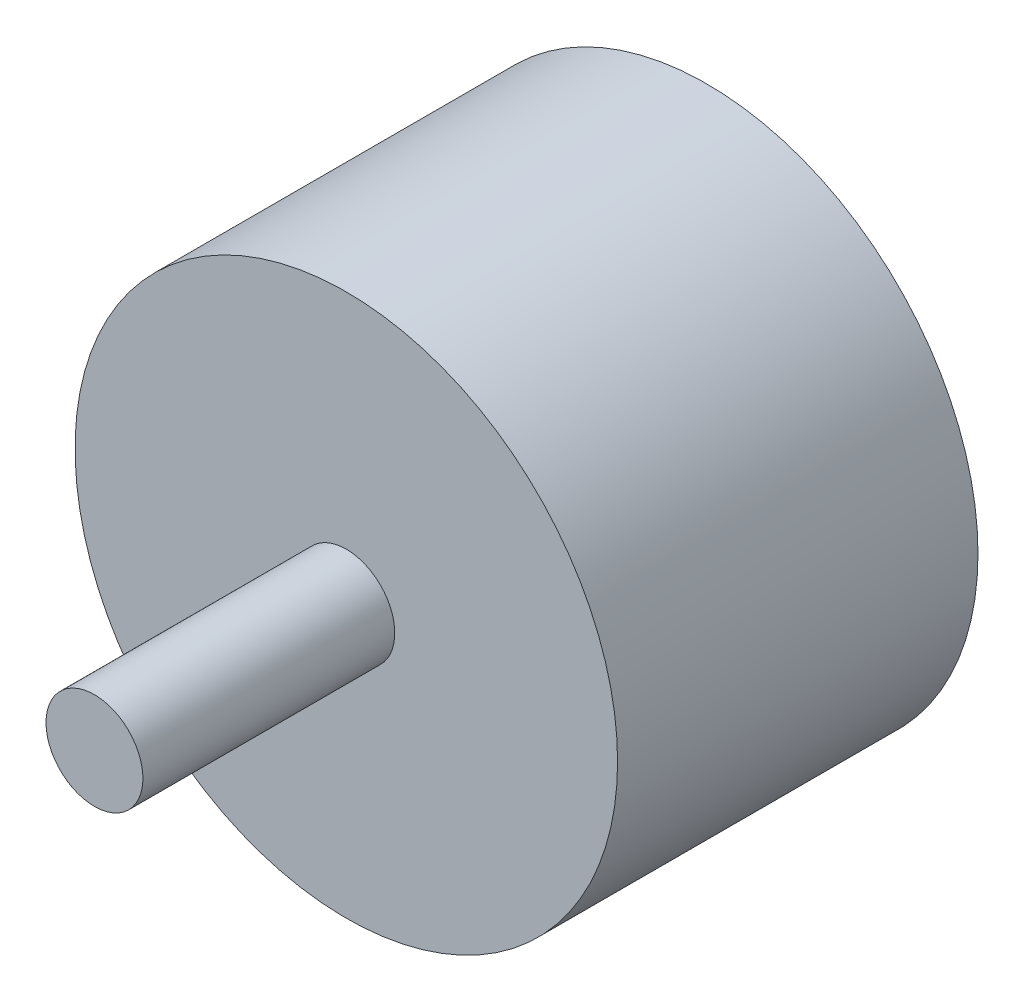
from build123d import *

# Parameters (mm, degrees)
SKETCH1_R           = 14
BOSS_EXTRUDE1_DEPTH = 18.6
SKETCH2_R           = 2.5
BOSS_EXTRUDE2_DEPTH = 13


with BuildPart() as part:
    # Sketch1 → Boss-Extrude1 (new body)
    with BuildSketch(Plane.XY):
        Circle(SKETCH1_R)
    extrude(amount=BOSS_EXTRUDE1_DEPTH)

    # Sketch2 → Boss-Extrude2 (add)
    with BuildSketch(Plane.XY.offset(18.6)):
        with Locations(Location((0, 0, 0), (0, 0, 180))):
            Circle(SKETCH2_R)
    extrude(amount=BOSS_EXTRUDE2_DEPTH)


solid = part.part
